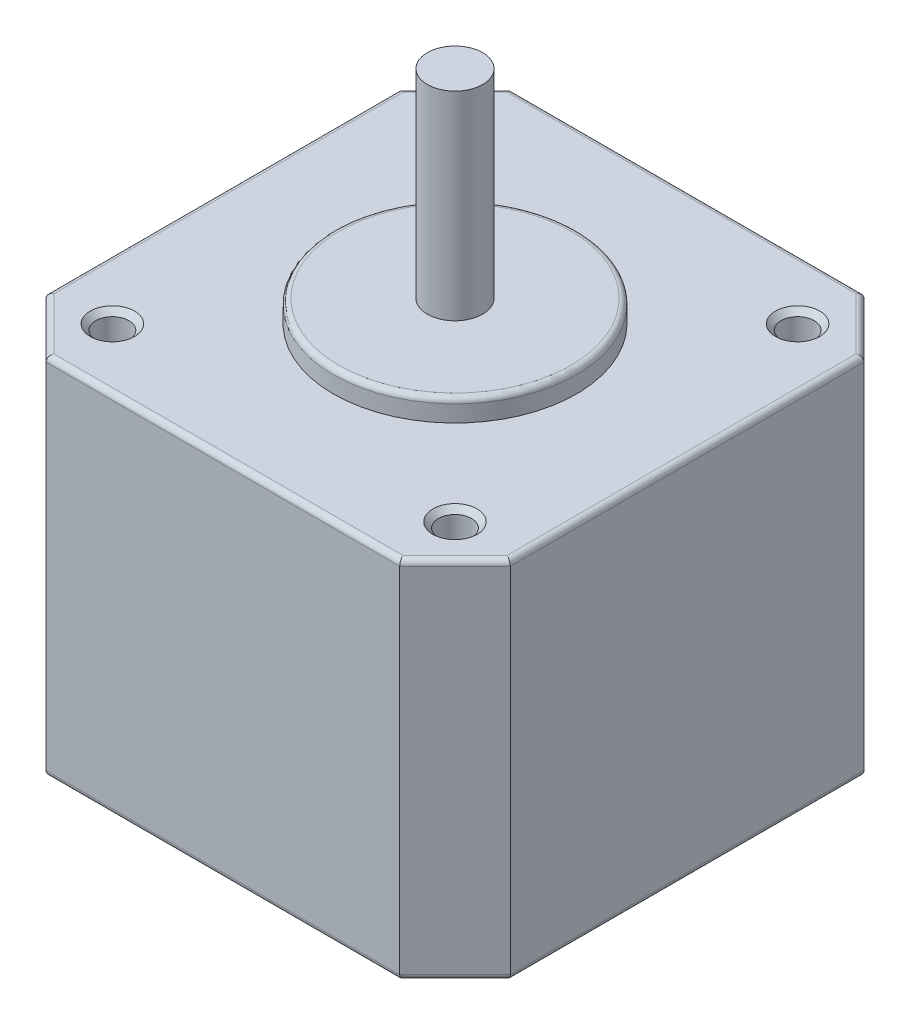
from build123d import *

# Parameters (mm, degrees)
SKETCH1_W           = 42
SKETCH1_H           = 42
BOSS_EXTRUDE1_DEPTH = 33
SKETCH2_R           = 11
BOSS_EXTRUDE2_DEPTH = 2
SKETCH3_R           = 2.5
BOSS_EXTRUDE3_DEPTH = 18
SKETCH4_R           = 1.5
CUT_EXTRUDE1_DEPTH  = 5
CHAMFER1_SIZE       = 5
CHAMFER2_SIZE       = 0.5
FILLET1_R           = 0.5
FILLET2_R           = 0.5


with BuildPart() as part:
    # Sketch1 → Boss-Extrude1 (new body)
    with BuildSketch(Plane(origin=(0, 0, 0), x_dir=(1, 0, 0), z_dir=(0, 1, 0))):
        Rectangle(SKETCH1_W, SKETCH1_H)
    extrude(amount=BOSS_EXTRUDE1_DEPTH)

    # Sketch2 → Boss-Extrude2 (add)
    with BuildSketch(Plane(origin=(0, 33, 0), x_dir=(1, 0, 0), z_dir=(0, 1, 0))):
        with Locations(Location((0, 0, 0), (0, 0, 270))):
            Circle(SKETCH2_R)
    extrude(amount=BOSS_EXTRUDE2_DEPTH)

    # Sketch3 → Boss-Extrude3 (add)
    with BuildSketch(Plane(origin=(0, 35, 0), x_dir=(1, 0, 0), z_dir=(0, 1, 0))):
        with Locations(Location((0, 0, 0), (0, 0, 270))):
            Circle(SKETCH3_R)
    extrude(amount=BOSS_EXTRUDE3_DEPTH)

    # Sketch4 → Cut-Extrude1 (cut)
    with BuildSketch(Plane(origin=(0, 33, 0), x_dir=(1, 0, 0), z_dir=(0, 1, 0))):
        with Locations(Location((-15.5, 15.5, 0), (0, 0, 270))):
            Circle(SKETCH4_R)
        with Locations(Location((15.5, 15.5, 0), (0, 0, 270))):
            Circle(SKETCH4_R)
        with Locations(Location((15.5, -15.5, 0), (0, 0, 270))):
            Circle(SKETCH4_R)
        with Locations(Location((-15.5, -15.5, 0), (0, 0, 270))):
            Circle(SKETCH4_R)
    extrude(amount=-CUT_EXTRUDE1_DEPTH, mode=Mode.SUBTRACT)

    # Chamfer1
    chamfer1_edges = [part.edges().sort_by_distance(p)[0] for p in [
        (-21, 16.5, -21),
        (21, 16.5, -21),
        (21, 16.5, 21),
        (-21, 16.5, 21),
    ]]
    chamfer(chamfer1_edges, length=CHAMFER1_SIZE)

    # Chamfer2
    chamfer2_edges = [part.edges().sort_by_distance(p)[0] for p in [
        (-15.5, 33, -17),
        (15.5, 33, -17),
        (15.5, 33, 14),
        (-15.5, 33, 14),
    ]]
    chamfer(chamfer2_edges, length=CHAMFER2_SIZE)

    # Fillet1
    fillet1_edges = [part.edges().sort_by_distance(p)[0] for p in [
        (0, 0, 21),
        (0, 33, 21),
        (-21, 0, 0),
        (0, 0, -21),
        (21, 0, 0),
        (18.5, 0, 18.5),
        (18.5, 0, -18.5),
        (-18.5, 0, -18.5),
        (-18.5, 0, 18.5),
        (-21, 33, 0),
        (21, 33, 0),
        (0, 33, -21),
        (18.5, 33, 18.5),
        (18.5, 33, -18.5),
        (-18.5, 33, -18.5),
        (-18.5, 33, 18.5),
    ]]
    fillet(fillet1_edges, radius=FILLET1_R)

    # Fillet2
    fillet2_edges = [part.edges().sort_by_distance(p)[0] for p in [
        (0, 35, -11),
    ]]
    fillet(fillet2_edges, radius=FILLET2_R)


solid = part.part
